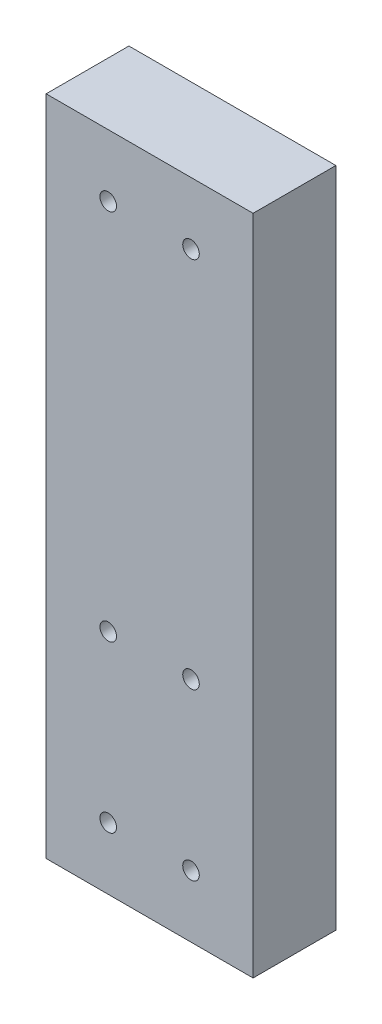
from build123d import *

# Parameters (mm, degrees)
SKETCH1_W           = 25
SKETCH1_H           = 80
BOSS_EXTRUDE1_DEPTH = 10
SKETCH2_R           = 1
CUT_EXTRUDE1_DEPTH  = 85.409715081


with BuildPart() as part:
    # Sketch1 → Boss-Extrude1 (new body)
    with BuildSketch(Plane.XY):
        with Locations((12.5, -40)):
            Rectangle(SKETCH1_W, SKETCH1_H)
    extrude(amount=BOSS_EXTRUDE1_DEPTH)

    # Sketch2 → Cut-Extrude1 (cut, through all)
    with BuildSketch(Plane.XY.offset(10)):
        with Locations((7.5, -52.5)):
            Circle(SKETCH2_R)
        with Locations((7.5, -72.5)):
            Circle(SKETCH2_R)
        with Locations((7.5, -7.5)):
            Circle(SKETCH2_R)
        with Locations(Location((17.5, -7.5, 0), (0, 0, 180))):
            Circle(SKETCH2_R)
        with Locations(Location((17.5, -52.5, 0), (0, 0, 180))):
            Circle(SKETCH2_R)
        with Locations(Location((17.5, -72.5, 0), (0, 0, 180))):
            Circle(SKETCH2_R)
    extrude(amount=-CUT_EXTRUDE1_DEPTH, mode=Mode.SUBTRACT)


solid = part.part
